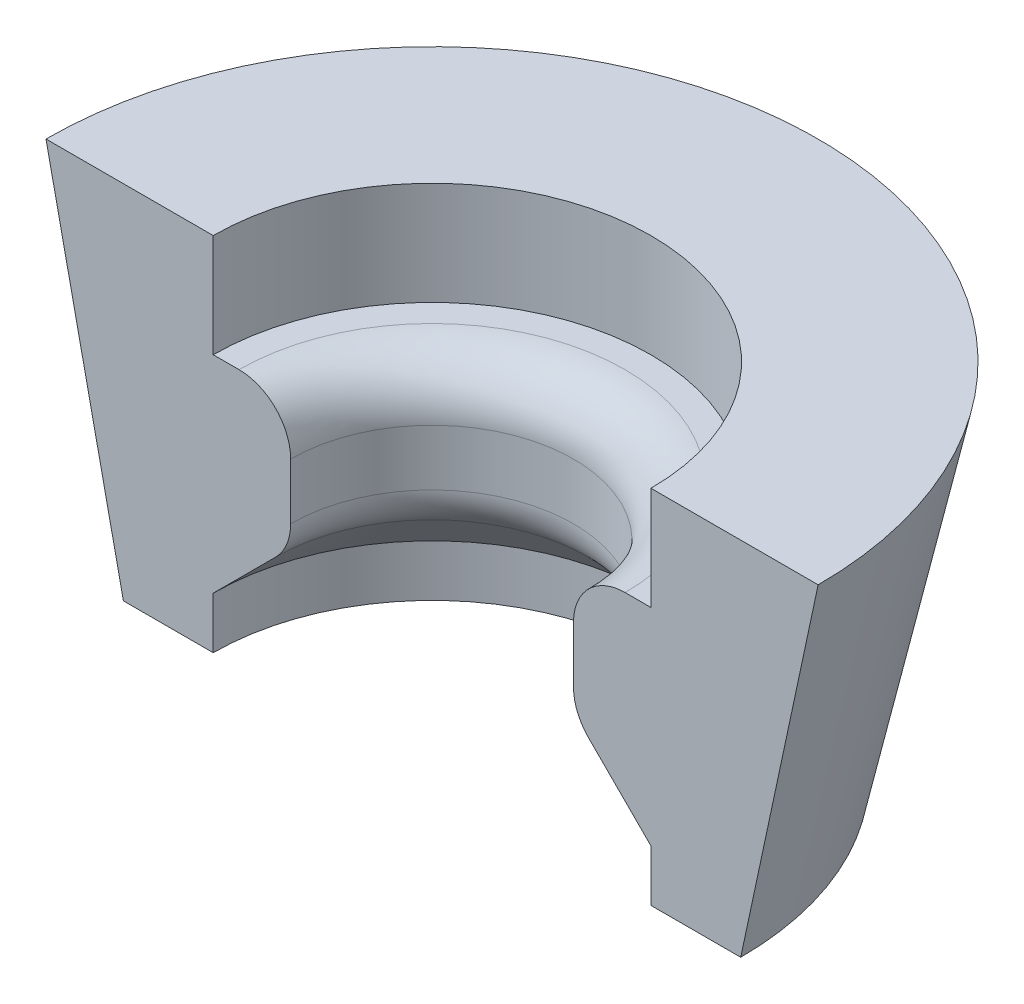
from build123d import *

# Parameters (mm, degrees)
REVOLVE1_ANGLE = 180


with BuildPart() as part:
    # Sketch1 → Revolve1 (revolve)
    with BuildSketch(Plane.XY):
        with BuildLine():
            Line((-3.3655, 1.5875), (-3.3655, 3.175))
            Line((-3.3655, 3.175), (-5.93725, 3.175))
            Line((-5.93725, 3.175), (-4.746625, -2.38125))
            Line((-4.746625, -2.38125), (-3.3655, -2.38125))
            Line((-3.3655, -2.38125), (-3.3655, -1.5875))
            Line((-3.3655, -1.5875), (-2.407358992, -0.629358992))
            ThreePointArc((-2.407358992, -0.629358992), (-2.235295621, -0.371847959), (-2.174875, -0.068092985))
            Line((-2.174875, -0.068092985), (-2.174875, 0.79375))
            ThreePointArc((-2.174875, 0.79375), (-2.407358992, 1.355016008), (-2.968625, 1.5875))
            Line((-2.968625, 1.5875), (-3.3655, 1.5875))
        make_face()
    revolve(axis=Axis((0, 1.5875, 0), (0, -1, 0)), revolution_arc=REVOLVE1_ANGLE)


solid = part.part
